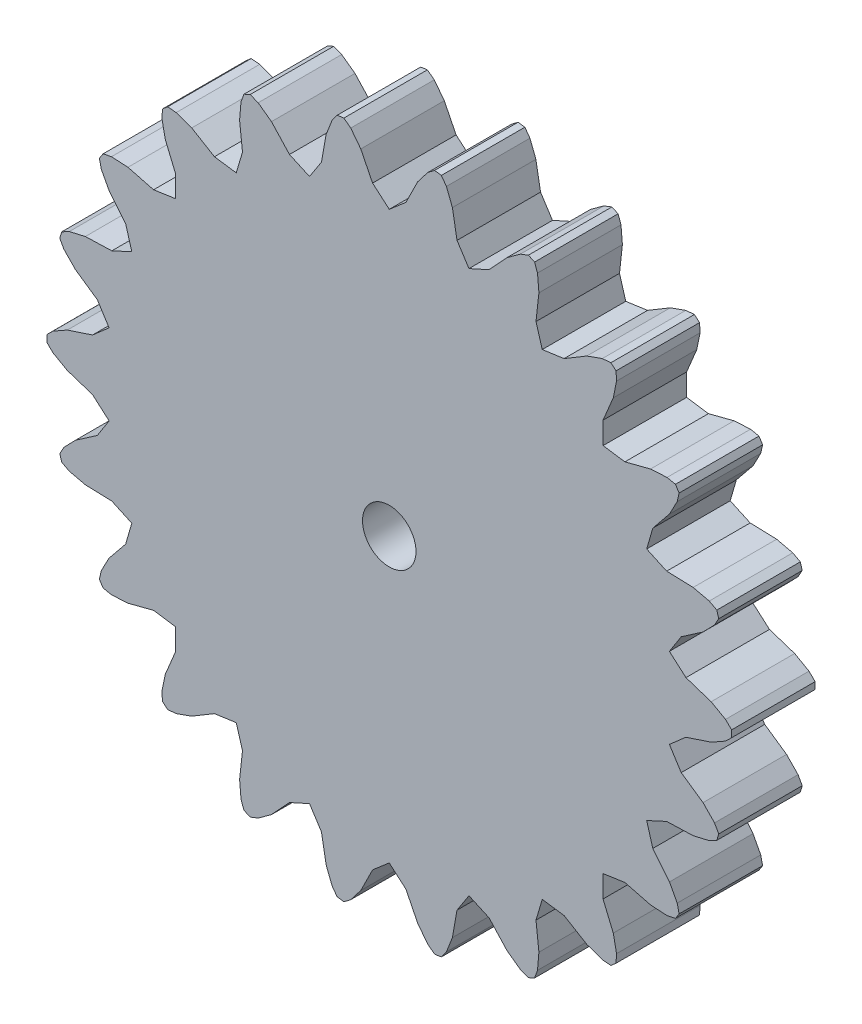
from build123d import *

# Parameters (mm, degrees)
SKETCH1_R               = 20.5
BOSS_EXTRUDE1_DEPTH     = 5
CUT_EXTRUDE1_DEPTH      = 30.419381367
CUT_EXTRUDE2_DEPTH      = 30.419381367
CUT_EXTRUDE2_DEPTH_BACK = 30.419381367
SKETCH4_R               = 1.6
CIRPATTERN1_COUNT       = 22


with BuildPart() as part:
    # Sketch1 → Boss-Extrude1 (new body)
    with BuildSketch(Plane.XY):
        Circle(SKETCH1_R)
    extrude(amount=BOSS_EXTRUDE1_DEPTH)

    # Sketch2 → Cut-Extrude1 (cut, through all)
    with BuildSketch(Plane.XY):
        Polygon((0, 16.944693036), (-0.998470792, 17.804120424), (-1.704297747, 19.225185361), (-2.306603416, 20.006300526), (-2.715384942, 20.31936723), (0, 24.503722989), (2.715384942, 20.31936723), (2.306603416, 20.006300526), (1.704297747, 19.225185361), (0.998470792, 17.804120424), align=None)
    cut_extrude1 = extrude(amount=CUT_EXTRUDE1_DEPTH, mode=Mode.SUBTRACT)

    # Sketch4 → Cut-Extrude2 (cut, two sides: drawn at the far end of the back side and taken through both)
    with BuildSketch(Plane.XY.offset(5).offset(-CUT_EXTRUDE2_DEPTH_BACK)):
        Circle(SKETCH4_R)
    extrude(amount=CUT_EXTRUDE2_DEPTH + CUT_EXTRUDE2_DEPTH_BACK, mode=Mode.SUBTRACT)

    # CirPattern1: Cut-Extrude1 ×22 about axis
    cirpattern1_axis = Axis((0, 0, 0), (0, 0, 1))
    for i in range(1, CIRPATTERN1_COUNT):
        add(cut_extrude1.rotate(cirpattern1_axis, i * 360 / CIRPATTERN1_COUNT), mode=Mode.SUBTRACT)


solid = part.part
